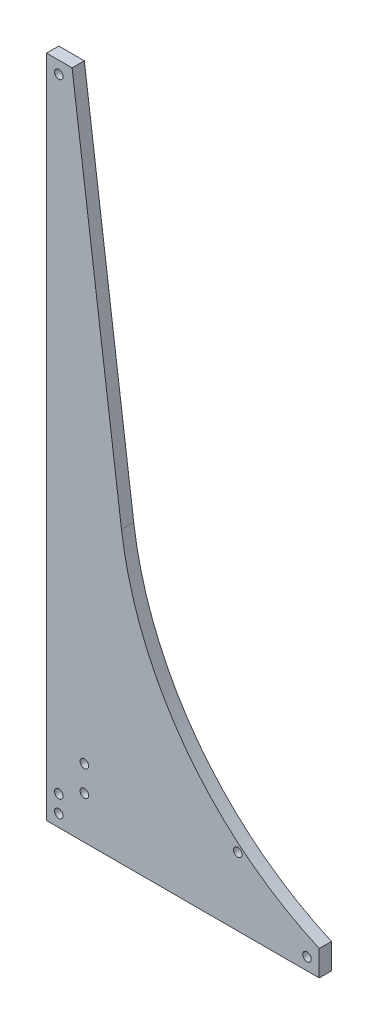
from build123d import *

# Parameters (mm, degrees)
SKETCH1_R           = 6.35
BOSS_EXTRUDE1_DEPTH = 18.25625


with BuildPart() as part:
    # Sketch1 → Boss-Extrude1 (new body)
    with BuildSketch(Plane.XY):
        with BuildLine():
            Line((0, 0), (406.4, 0))
            Line((406.4, 0), (406.4, 38.1))
            ThreePointArc((406.4, 38.1), (207.539140749, 196.40002074), (111.667415652, 431.8))
            Line((111.667415652, 431.8), (38.1, 990.6))
            Line((38.1, 990.6), (0, 990.6))
            Line((0, 990.6), (0, 0))
        make_face()
        with Locations((18.25625, 18.25625)):
            Circle(SKETCH1_R, mode=Mode.SUBTRACT)
        with Locations((388.14375, 18.25625)):
            Circle(SKETCH1_R, mode=Mode.SUBTRACT)
        with Locations((18.25625, 972.34375)):
            Circle(SKETCH1_R, mode=Mode.SUBTRACT)
        with Locations((56.35625, 101.6)):
            Circle(SKETCH1_R, mode=Mode.SUBTRACT)
        with Locations((284.95625, 101.6)):
            Circle(SKETCH1_R, mode=Mode.SUBTRACT)
        with Locations((18.25625, 43.65625)):
            Circle(SKETCH1_R, mode=Mode.SUBTRACT)
        with Locations((56.35625, 63.5)):
            Circle(SKETCH1_R, mode=Mode.SUBTRACT)
    extrude(amount=BOSS_EXTRUDE1_DEPTH)


solid = part.part
